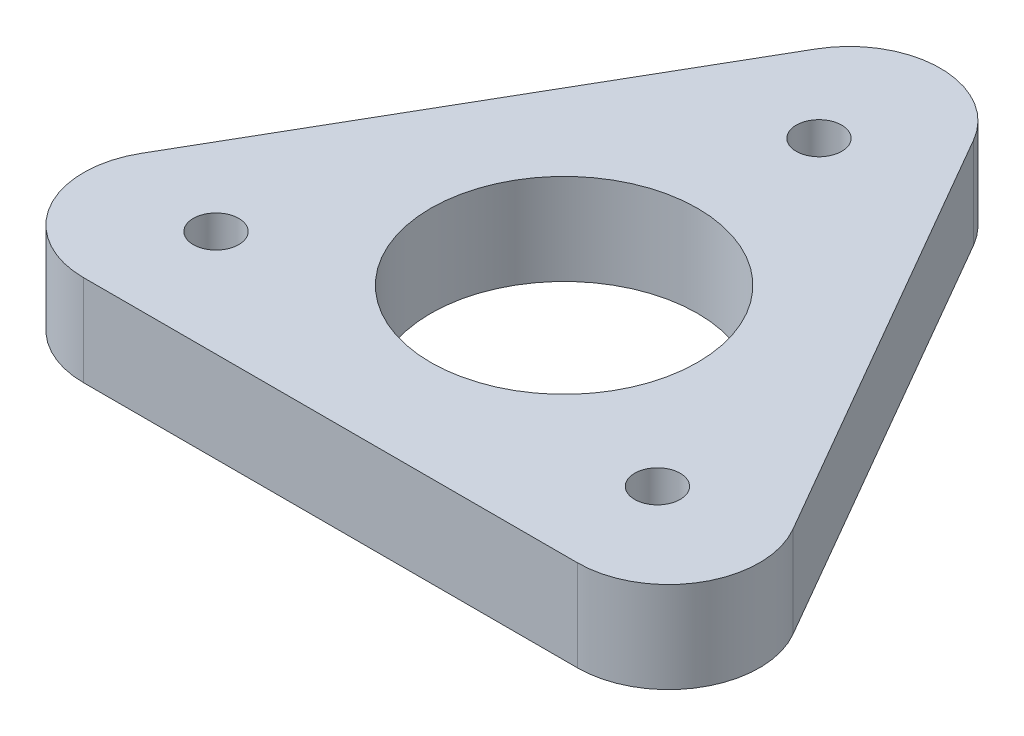
from build123d import *

# Parameters (mm, degrees)
ESQUISSE1_R        = 4.4
ESQUISSE1_R_2      = 0.75
BOSS_EXTRU_1_DEPTH = 3


with BuildPart() as part:
    # Esquisse1 → Boss.-Extru.1 (new body)
    with BuildSketch(Plane(origin=(0, 0, 0), x_dir=(1, 0, 0), z_dir=(0, 1, 0))):
        with BuildLine():
            Line((-2.598076211, 10.9), (-10.738715007, -3.2))
            ThreePointArc((-10.738715007, -3.2), (-10.738715007, -6.2), (-8.140638796, -7.7))
            Line((-8.140638796, -7.7), (8.140638796, -7.7))
            ThreePointArc((8.140638796, -7.7), (10.738715007, -6.2), (10.738715007, -3.2))
            Line((10.738715007, -3.2), (2.598076211, 10.9))
            ThreePointArc((2.598076211, 10.9), (0, 12.4), (-2.598076211, 10.9))
        make_face()
        with Locations(Location((0, 0, 0), (0, 0, 270))):
            Circle(ESQUISSE1_R, mode=Mode.SUBTRACT)
        with Locations(Location((0, 8.4, 0), (0, 0, 270))):
            Circle(ESQUISSE1_R_2, mode=Mode.SUBTRACT)
        with Locations(Location((7.274613392, -4.2, 0), (0, 0, 270))):
            Circle(ESQUISSE1_R_2, mode=Mode.SUBTRACT)
        with Locations(Location((-7.274613392, -4.2, 0), (0, 0, 270))):
            Circle(ESQUISSE1_R_2, mode=Mode.SUBTRACT)
    extrude(amount=BOSS_EXTRU_1_DEPTH)


solid = part.part
